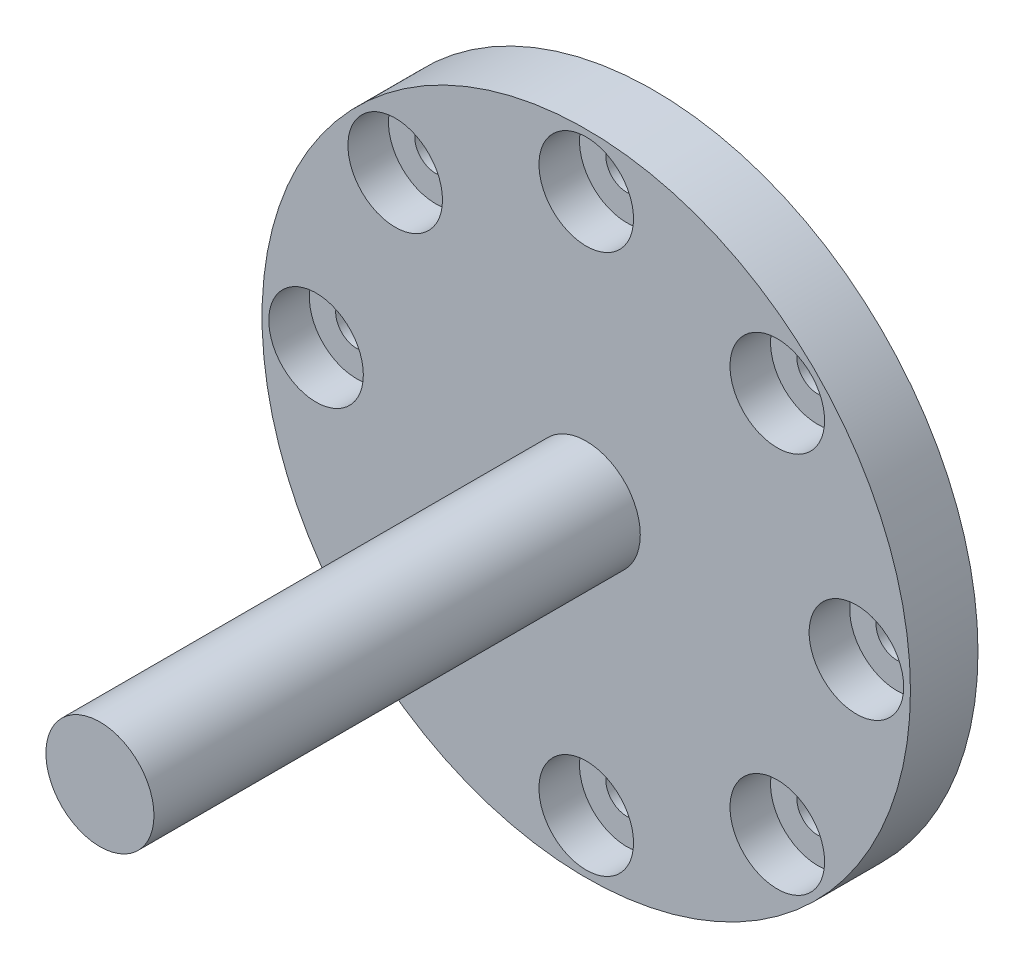
from build123d import *

# Parameters (mm, degrees)
SKETCH6_R           = 24
BOSS_EXTRUDE1_DEPTH = 5
SKETCH8_R           = 1.55
CUT_EXTRUDE6_DEPTH  = 5
SKETCH10_R          = 4
BOSS_EXTRUDE2_DEPTH = 36
SKETCH11_R          = 3.5
CUT_EXTRUDE8_DEPTH  = 3


with BuildPart() as part:
    # Sketch6 → Boss-Extrude1 (new body)
    with BuildSketch(Plane.XY):
        Circle(SKETCH6_R)
    extrude(amount=BOSS_EXTRUDE1_DEPTH)

    # Sketch8 → Cut-Extrude6 (cut)
    with BuildSketch(Plane(origin=(0, 0, 0), x_dir=(-1, 0, 0), z_dir=(0, 0, -1))):
        with Locations((0, 20)):
            Circle(SKETCH8_R)
        with Locations((14.142135624, 14.142135624)):
            Circle(SKETCH8_R)
        with Locations((20, 0)):
            Circle(SKETCH8_R)
        with Locations((14.142135624, -14.142135624)):
            Circle(SKETCH8_R)
        with Locations((0, -20)):
            Circle(SKETCH8_R)
        with Locations((-14.142135624, -14.142135624)):
            Circle(SKETCH8_R)
        with Locations((-20, 0)):
            Circle(SKETCH8_R)
        with Locations((-14.142135624, 14.142135624)):
            Circle(SKETCH8_R)
    extrude(amount=-CUT_EXTRUDE6_DEPTH, mode=Mode.SUBTRACT)

    # Sketch10 → Boss-Extrude2 (add)
    with BuildSketch(Plane.XY.offset(5)):
        Circle(SKETCH10_R)
    extrude(amount=BOSS_EXTRUDE2_DEPTH)

    # Sketch11 → Cut-Extrude8 (cut)
    with BuildSketch(Plane.XY.offset(5)):
        with Locations((0, 20)):
            Circle(SKETCH11_R)
        with Locations((14.142135624, 14.142135624)):
            Circle(SKETCH11_R)
        with Locations((20, 0)):
            Circle(SKETCH11_R)
        with Locations((14.142135624, -14.142135624)):
            Circle(SKETCH11_R)
        with Locations((0, -20)):
            Circle(SKETCH11_R)
        with Locations((-14.142135624, -14.142135624)):
            Circle(SKETCH11_R)
        with Locations((-20, 0)):
            Circle(SKETCH11_R)
        with Locations((-14.142135624, 14.142135624)):
            Circle(SKETCH11_R)
    extrude(amount=-CUT_EXTRUDE8_DEPTH, mode=Mode.SUBTRACT)


solid = part.part
